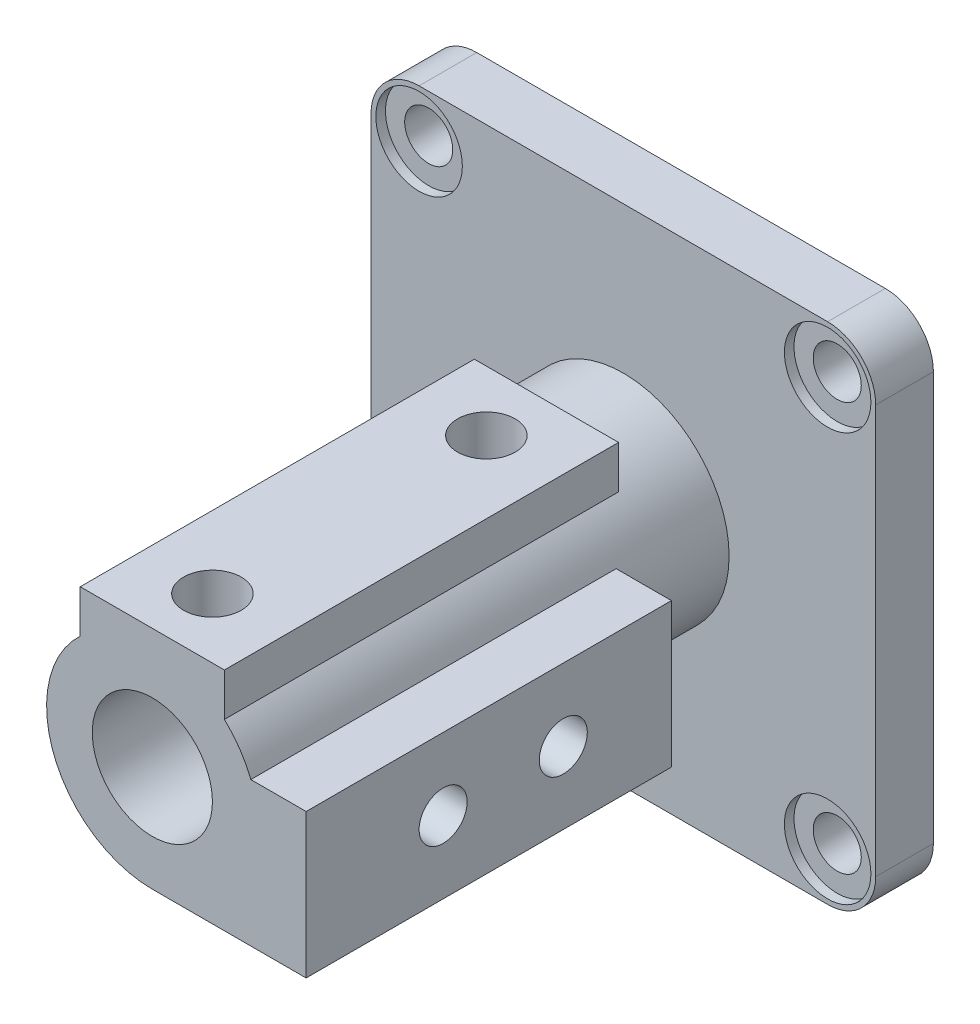
from build123d import *

# Parameters (mm, degrees)
SKETCH1_W           = 105
SKETCH1_H           = 105
BOSS_EXTRUDE1_DEPTH = 12
SKETCH2_R           = 22
BOSS_EXTRUDE2_DEPTH = 98
BOSS_EXTRUDE3_START = -82
BOSS_EXTRUDE3_DEPTH = 82
HOLE1_D             = 25
HOLE2_REACH         = 146.439
HOLE2_BORE_R        = 6
BOSS_EXTRUDE4_START = -76
BOSS_EXTRUDE4_DEPTH = 76
HOLE3_REACH         = 150.312
HOLE3_BORE_R        = 5
FILLET1_R           = 10
HOLE4_D             = 10
HOLE4_CBORE_D       = 18
HOLE4_CBORE_DEPTH   = 2


with BuildPart() as part:
    # Sketch1 → Boss-Extrude1 (new body)
    with BuildSketch(Plane.XY):
        Rectangle(SKETCH1_W, SKETCH1_H)
    extrude(amount=BOSS_EXTRUDE1_DEPTH)

    # Sketch2 → Boss-Extrude2 (add)
    with BuildSketch(Plane.XY.offset(12)):
        Circle(SKETCH2_R)
    extrude(amount=BOSS_EXTRUDE2_DEPTH)

    # Sketch3 → Boss-Extrude3 (add)
    with BuildSketch(Plane.XY.offset(110).offset(BOSS_EXTRUDE3_START)):
        with BuildLine():
            Line((-15, 16.093476939), (-15, 25))
            Line((-15, 25), (15, 25))
            Line((15, 25), (15, 16.093476939))
            ThreePointArc((15, 16.093476939), (0, 22), (-15, 16.093476939))
        make_face()
    extrude(amount=BOSS_EXTRUDE3_DEPTH)

    # Hole1 (through all)
    with Locations(Plane.XY.offset(110)):
        with Locations((0, 0)):
            Hole(HOLE1_D / 2)

    # Hole2 bore → Hole2 (cut, up to next)
    with BuildSketch(Plane(origin=(0, 25, 0), x_dir=(1, 0, 0), z_dir=(0, 1, 0)), mode=Mode.PRIVATE) as hole2_sk1:
        with Locations((0, -40.5)):
            Circle(HOLE2_BORE_R)
    hole2_tool1 = extrude(hole2_sk1.sketch, amount=-HOLE2_REACH, mode=Mode.PRIVATE) & part.part
    # Hole2 bore → Hole2 (cut, up to next)
    with BuildSketch(Plane(origin=(0, 25, 0), x_dir=(1, 0, 0), z_dir=(0, 1, 0)), mode=Mode.PRIVATE) as hole2_sk2:
        with Locations((0, -97.5)):
            Circle(HOLE2_BORE_R)
    hole2_tool2 = extrude(hole2_sk2.sketch, amount=-HOLE2_REACH, mode=Mode.PRIVATE) & part.part
    add(hole2_tool1.solids().sort_by_distance((0, 25, 40.5))[0], mode=Mode.SUBTRACT)
    add(hole2_tool2.solids().sort_by_distance((0, 25, 97.5))[0], mode=Mode.SUBTRACT)

    # Sketch9 → Boss-Extrude4 (add)
    with BuildSketch(Plane.XY.offset(110).offset(BOSS_EXTRUDE4_START)):
        with BuildLine():
            Line((0, -22), (32, -22))
            Line((32, -22), (32, 8))
            Line((32, 8), (20.493901532, 8))
            ThreePointArc((20.493901532, 8), (18.165902125, -12.409673646), (0, -22))
        make_face()
    extrude(amount=BOSS_EXTRUDE4_DEPTH)

    # Hole3 bore → Hole3 (cut, up to next)
    with BuildSketch(Plane(origin=(32, 0, 0), x_dir=(0, 0, -1), z_dir=(1, 0, 0)), mode=Mode.PRIVATE) as hole3_sk1:
        with Locations((-81.5, -7)):
            Circle(HOLE3_BORE_R)
    hole3_tool1 = extrude(hole3_sk1.sketch, amount=-HOLE3_REACH, mode=Mode.PRIVATE) & part.part
    # Hole3 bore → Hole3 (cut, up to next)
    with BuildSketch(Plane(origin=(32, 0, 0), x_dir=(0, 0, -1), z_dir=(1, 0, 0)), mode=Mode.PRIVATE) as hole3_sk2:
        with Locations((-56.5, -7)):
            Circle(HOLE3_BORE_R)
    hole3_tool2 = extrude(hole3_sk2.sketch, amount=-HOLE3_REACH, mode=Mode.PRIVATE) & part.part
    add(hole3_tool1.solids().sort_by_distance((32, -7, 81.5))[0], mode=Mode.SUBTRACT)
    add(hole3_tool2.solids().sort_by_distance((32, -7, 56.5))[0], mode=Mode.SUBTRACT)

    # Fillet1
    fillet1_edges = [part.edges().sort_by_distance(p)[0] for p in [
        (52.5, -52.5, 6),
        (-52.5, -52.5, 6),
        (-52.5, 52.5, 6),
        (52.5, 52.5, 6),
    ]]
    fillet(fillet1_edges, radius=FILLET1_R)

    # Hole4 (through all)
    with Locations(Plane.XY.offset(12)):
        with Locations((42.5, -42.5), (42.5, 42.5), (-42.5, 42.5), (-42.5, -42.5)):
            CounterBoreHole(HOLE4_D / 2, HOLE4_CBORE_D / 2, HOLE4_CBORE_DEPTH)


solid = part.part
